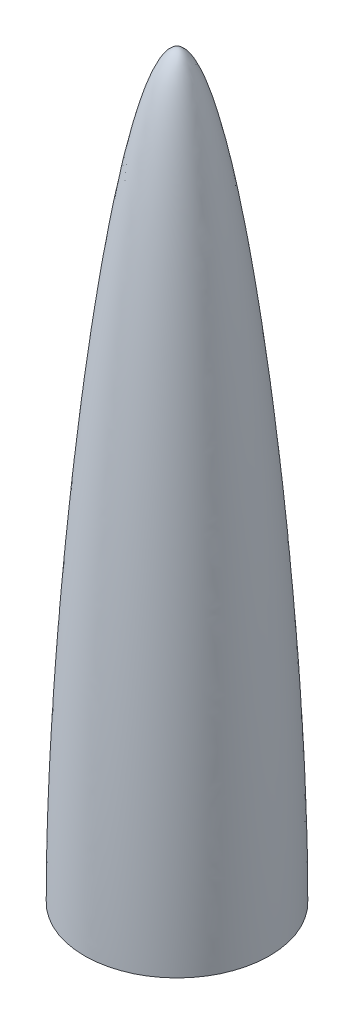
from build123d import *


with BuildPart() as part:
    # Sketch1 → Revolve1 (revolve)
    with BuildSketch(Plane.XY, mode=Mode.PRIVATE) as revolve1_sk:
        with BuildLine():
            Line((0, 403.069458147), (0, 412.75))
            add(Edge.make_bspline(
                [(0, 412.75), (25.4, 412.75), (51.59375, 152.4), (51.59375, 0)],
                knots=[0, 0, 0, 0, 1, 1, 1, 1], degree=3))
            Line((51.59375, 0), (47.459925842, 0))
            Line((47.459925842, 0), (47.459925842, 4.1275))
            add(Edge.make_bspline(
                [(4.1275, 403.069458147), (4.292023637, 402.747413471), (4.605634702, 402.113699513), (5.259029357, 400.714319487), (6.080525572, 398.802814151), (7.080127661, 396.235904149), (8.420819663, 392.4721057), (10.105321711, 387.147151323), (12.123502842, 379.832445691), (14.128845289, 371.65121683), (16.776022866, 359.660430734), (20.020870541, 342.773209039), (23.775606957, 319.872013846), (27.359943181, 294.724294429), (30.744231406, 267.715477189), (33.899718669, 239.22837658), (36.798067521, 209.644450359), (39.411177746, 179.344383779), (41.711086588, 148.708460893), (43.669922699, 118.116805641), (44.994890425, 92.977467608), (45.856563157, 73.268425899), (46.400209896, 58.735532221), (46.837798789, 44.498916895), (47.111204808, 32.922539677), (47.273470952, 23.856006914), (47.366500737, 17.163999749), (47.430492642, 10.567060356), (47.453369816, 6.283580592), (47.459925842, 4.1275)],
                knots=[0.102456086, 0.102456086, 0.102456086, 0.102456086, 0.109397848, 0.116339609, 0.130223132, 0.144106655, 0.157990177, 0.185757223, 0.213524268, 0.241291314, 0.269058359, 0.32459245, 0.380126541, 0.435660631, 0.491194722, 0.546728813, 0.602262904, 0.657796995, 0.713331086, 0.768865177, 0.824399267, 0.852166313, 0.879933358, 0.907700404, 0.935467449, 0.949350972, 0.963234494, 0.977118017, 0.99100154, 0.99100154, 0.99100154, 0.99100154], degree=3))
            Line((4.1275, 403.069458147), (0, 403.069458147))
        make_face()
    revolve(revolve1_sk.sketch.rotate(Axis((0, 433.3875, 0), (0, -1, 0)), 90), axis=Axis((0, 433.3875, 0), (0, -1, 0)))


solid = part.part
